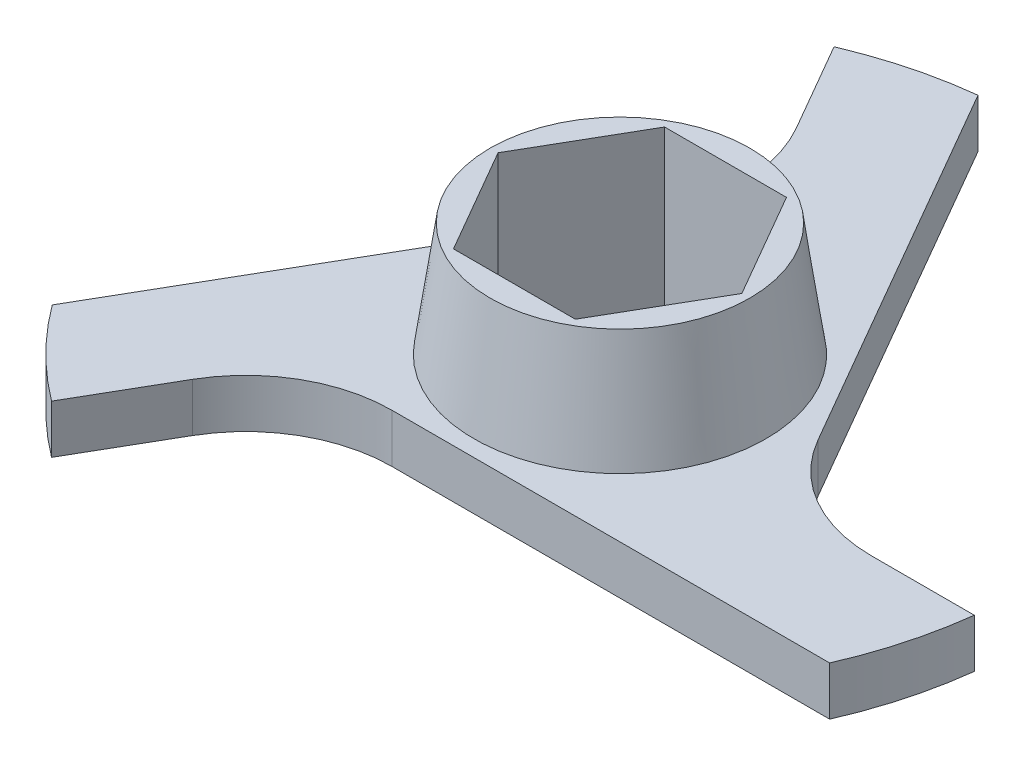
from build123d import *

# Parameters (mm, degrees)
SKETCH1_R           = 1.9
BOSS_EXTRUDE1_DEPTH = 10
CIRPATTERN1_COUNT   = 3
CUT_EXTRUDE1_DEPTH  = 10


with BuildPart() as part:
    # Sketch1 → Boss-Extrude1 (new body)
    with BuildSketch(Plane(origin=(0, 0, 0), x_dir=(1, 0, 0), z_dir=(0, 1, 0))):
        with BuildLine():
            ThreePointArc((-2.7961852, 24.843134833), (-6.371318495, 24.174496905), (-9.811597435, 22.99418526))
            Line((-9.811597435, 22.99418526), (-6.639528096, 17.5))
            ThreePointArc((-6.639528096, 17.5), (-5.43375673, 13), (-6.639528096, 8.5))
            Line((-6.639528096, 8.5), (-17.320508076, -10))
            Line((-17.320508076, -10), (17.320508076, -10))
            Line((17.320508076, -10), (-2.7961852, 24.843134833))
        make_face()
        with Locations(Location((0, 0, 0), (0, 0, 270))):
            Circle(SKETCH1_R, mode=Mode.SUBTRACT)
    boss_extrude1 = extrude(amount=BOSS_EXTRUDE1_DEPTH)

    # CirPattern1: Boss-Extrude1 ×3 about axis
    cirpattern1_axis = Axis((0, 0, 0), (0, 1, 0))
    for i in range(1, CIRPATTERN1_COUNT):
        add(boss_extrude1.rotate(cirpattern1_axis, i * 360 / CIRPATTERN1_COUNT))

    # Sketch3 → Cut-Extrude1 (cut)
    with BuildSketch(Plane(origin=(0, 10, 0), x_dir=(1, 0, 0), z_dir=(0, 1, 0))):
        Polygon((3.75277675, 6.5), (-3.75277675, 6.5), (-7.505553499, 0), (-3.75277675, -6.5), (3.75277675, -6.5), (7.505553499, 0), align=None)
    extrude(amount=-CUT_EXTRUDE1_DEPTH, mode=Mode.SUBTRACT)

    # Sketch5 → Cut-Revolve2 (revolve, cut)
    with BuildSketch(Plane.XY, mode=Mode.PRIVATE) as cut_revolve2_sk:
        Polygon((8, 10), (29.75960594, 10), (29.75960594, 3), (9, 3), align=None)
    revolve(cut_revolve2_sk.sketch.rotate(Axis((0, 0, 0), (0, 1, 0)), 90), axis=Axis((0, 0, 0), (0, 1, 0)), mode=Mode.SUBTRACT)


solid = part.part
